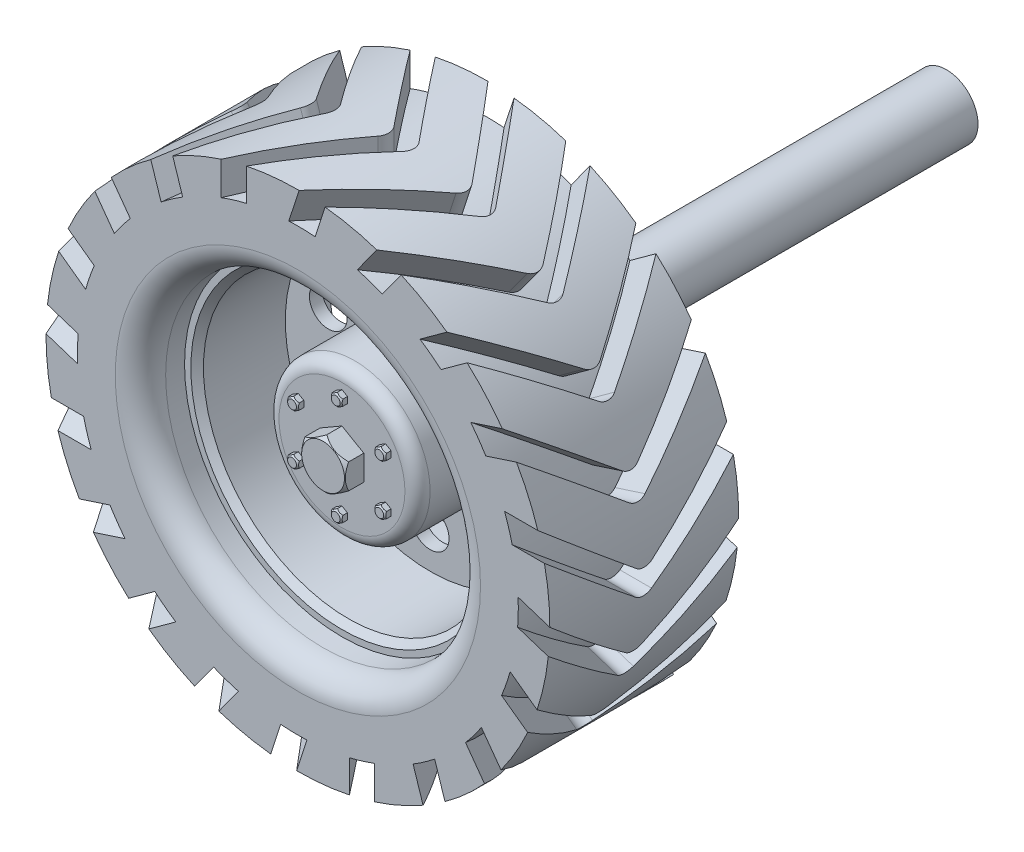
from build123d import *

# Parameters (mm, degrees)
SKETCH_1_R               = 125
EXTRUDE_1_DEPTH          = 40
SHELL_1_T                = -10
SKETCH_3_R               = 200
SKETCH_3_R_2             = 125
EXTRUDE_2_DEPTH          = 75
CHAMFER_1_SIZE           = 5
FILLET_2_R               = 20
SKETCH_4_R               = 60
EXTRUDE_3_DEPTH          = 70
FILLET_4_R               = 10
SKETCH_5_R               = 15
CUT_EXTRUDE_2_DEPTH      = 100
PATTERN_CIRCULAR_1_COUNT = 10
FILLET_5_R               = 5
SKETCH_7_R               = 20
EXTRUDE_5_DEPTH          = 15
CHAMFER_2_SIZE           = 3
CUT_EXTRUDE_START        = -15
CUT_EXTRUDE_3_DEPTH      = 15
SKETCH_9_R               = 5
EXTRUDE_6_DEPTH          = 5
CHAMFER_3_SIZE           = 1.5
PATTERN_CIRCULAR_2_COUNT = 6
CHAMFER_4_SIZE           = 1.5
CUT_EXTRUDE_START_2      = -5
CUT_EXTRUDE_4_DEPTH      = 5
PATTERN_CIRCULAR_4_COUNT = 6
CUT_EXTRUDE_5_REACH      = 545.714
CUT_EXTRUDE_5_END_RADIUS = 175
PATTERN_CIRCULAR_6_COUNT = 20
SKETCH_14_R              = 25
EXTRUDE_7_DEPTH          = 400


with BuildPart() as part:
    # 草圖1 → 填料-伸長1 (new, symmetric)
    with BuildSketch(Plane.XY):
        Circle(SKETCH_1_R)
    extrude(amount=EXTRUDE_1_DEPTH, both=True)

    # 薄殼1
    shell_1_openings = [part.faces().sort_by_distance(p)[0] for p in [
        (0, 0, 40),
    ]]
    offset(amount=SHELL_1_T, openings=shell_1_openings, kind=Kind.INTERSECTION)

    # 草圖3 → 填料-伸長2 (add, symmetric)
    with BuildSketch(Plane.XY):
        Circle(SKETCH_3_R)
        Circle(SKETCH_3_R_2, mode=Mode.SUBTRACT)
    extrude(amount=EXTRUDE_2_DEPTH, both=True)

    # 導角1
    chamfer_1_edges = [part.edges().sort_by_distance(p)[0] for p in [
        (-115, 0, 40),
    ]]
    chamfer(chamfer_1_edges, length=CHAMFER_1_SIZE)

    # 圓角2
    fillet_2_edges = [part.edges().sort_by_distance(p)[0] for p in [
        (-125, 0, 75),
    ]]
    fillet(fillet_2_edges, radius=FILLET_2_R)

    # 草圖4 → 填料-伸長3 (add)
    with BuildSketch(Plane.XY.offset(-30)):
        Circle(SKETCH_4_R)
    extrude(amount=EXTRUDE_3_DEPTH)

    # 圓角4
    fillet_4_edges = [part.edges().sort_by_distance(p)[0] for p in [
        (-60, 0, 40),
    ]]
    fillet(fillet_4_edges, radius=FILLET_4_R)

    # 草圖5 → 除料-伸長2 (cut)
    with BuildSketch(Plane.XY.offset(-30)):
        with Locations((0, 85)):
            Circle(SKETCH_5_R)
    cut_extrude_2 = extrude(amount=-CUT_EXTRUDE_2_DEPTH, mode=Mode.SUBTRACT)

    # 環狀複製排列1: 除料-伸長2 ×10 about axis
    pattern_circular_1_axis = Axis((0, 0, 0), (0, 0, 1))
    for i in range(1, PATTERN_CIRCULAR_1_COUNT):
        add(cut_extrude_2.rotate(pattern_circular_1_axis, i * 360 / PATTERN_CIRCULAR_1_COUNT), mode=Mode.SUBTRACT)

    # 圓角5
    fillet_5_edges = [part.edges().sort_by_distance(p)[0] for p in [
        (-60, 0, -30),
    ]]
    fillet(fillet_5_edges, radius=FILLET_5_R)

    # 草圖7 → 填料-伸長5 (add)
    with BuildSketch(Plane.XY.offset(40)):
        Circle(SKETCH_7_R)
    extrude(amount=EXTRUDE_5_DEPTH)

    # 導角2
    chamfer_2_edges = [part.edges().sort_by_distance(p)[0] for p in [
        (-20, 0, 55),
    ]]
    chamfer(chamfer_2_edges, length=CHAMFER_2_SIZE)

    # 草圖8 → 除料-伸長3 (cut)
    with BuildSketch(Plane.XY.offset(55).offset(CUT_EXTRUDE_START)):
        with BuildLine():
            Line((-17.320508076, 10), (0, 20))
            ThreePointArc((0, 20), (-10, 17.320508076), (-17.320508076, 10))
        make_face()
        with BuildLine():
            ThreePointArc((17.320508076, 10), (10, 17.320508076), (0, 20))
            Line((0, 20), (17.320508076, 10))
        make_face()
        with BuildLine():
            Line((-17.320508076, -10), (-17.320508076, 10))
            ThreePointArc((-17.320508076, 10), (-20, 0), (-17.320508076, -10))
        make_face()
        with BuildLine():
            Line((0, -20), (-17.320508076, -10))
            ThreePointArc((-17.320508076, -10), (-10, -17.320508076), (0, -20))
        make_face()
        with BuildLine():
            ThreePointArc((0, -20), (10, -17.320508076), (17.320508076, -10))
            Line((17.320508076, -10), (0, -20))
        make_face()
        with BuildLine():
            ThreePointArc((20, 0), (19.318516526, 5.176380902), (17.320508076, 10))
            Line((17.320508076, 10), (17.320508076, -10))
            ThreePointArc((17.320508076, -10), (19.318516526, -5.176380902), (20, 0))
        make_face()
    extrude(amount=CUT_EXTRUDE_3_DEPTH, mode=Mode.SUBTRACT)

    # 草圖9 → 填料-伸長6 (add)
    with BuildSketch(Plane.XY.offset(40)):
        with Locations((0, 40)):
            Circle(SKETCH_9_R)
    extrude_6 = extrude(amount=EXTRUDE_6_DEPTH)

    # 導角3
    chamfer_3_edges = [part.edges().sort_by_distance(p)[0] for p in [
        (-5, 40, 45),
    ]]
    chamfer(chamfer_3_edges, length=CHAMFER_3_SIZE)

    # 環狀複製排列2: 填料-伸長6 ×6 about axis
    pattern_circular_2_axis = Axis((0, 0, 0), (0, 0, 1))
    for i in range(1, PATTERN_CIRCULAR_2_COUNT):
        add(extrude_6.rotate(pattern_circular_2_axis, i * 360 / PATTERN_CIRCULAR_2_COUNT))

    # 導角4
    chamfer_4_edges = [part.edges().sort_by_distance(p)[0] for p in [
        (-37.141016151, 15.669872981, 45),
        (-32.141016151, -24.330127019, 45),
        (5, -40, 45),
        (37.141016151, -15.669872981, 45),
        (32.141016151, 24.330127019, 45),
    ]]
    chamfer(chamfer_4_edges, length=CHAMFER_4_SIZE)

    # 草圖10 → 除料-伸長4 (cut)
    with BuildSketch(Plane.XY.offset(45).offset(CUT_EXTRUDE_START_2)):
        with BuildLine():
            Line((-4.330127019, 42.5), (0, 45))
            ThreePointArc((0, 45), (-2.5, 44.330127019), (-4.330127019, 42.5))
        make_face()
        with BuildLine():
            ThreePointArc((4.330127019, 42.5), (2.5, 44.330127019), (0, 45))
            Line((0, 45), (4.330127019, 42.5))
        make_face()
        with BuildLine():
            Line((-4.330127019, 37.5), (-4.330127019, 42.5))
            ThreePointArc((-4.330127019, 42.5), (-5, 40), (-4.330127019, 37.5))
        make_face()
        with BuildLine():
            Line((0, 35), (-4.330127019, 37.5))
            ThreePointArc((-4.330127019, 37.5), (-2.5, 35.669872981), (0, 35))
        make_face()
        with BuildLine():
            ThreePointArc((0, 35), (2.5, 35.669872981), (4.330127019, 37.5))
            Line((4.330127019, 37.5), (0, 35))
        make_face()
        with BuildLine():
            ThreePointArc((5, 40), (4.829629131, 41.294095226), (4.330127019, 42.5))
            Line((4.330127019, 42.5), (4.330127019, 37.5))
            ThreePointArc((4.330127019, 37.5), (4.829629131, 38.705904774), (5, 40))
        make_face()
    cut_extrude_4 = extrude(amount=CUT_EXTRUDE_4_DEPTH, mode=Mode.SUBTRACT)

    # 環狀複製排列4: 除料-伸長4 ×6 about axis
    pattern_circular_4_axis = Axis((0, 0, 0), (0, 0, 1))
    for i in range(1, PATTERN_CIRCULAR_4_COUNT):
        add(cut_extrude_4.rotate(pattern_circular_4_axis, i * 360 / PATTERN_CIRCULAR_4_COUNT), mode=Mode.SUBTRACT)

    # 除料-伸長5: up to this cylinder (the profile starts outside it)
    cut_extrude_5_end = Plane(origin=(0, 0, -39.585833), z_dir=(0, 0, -1)) * Cylinder(CUT_EXTRUDE_5_END_RADIUS, 1442.428, mode=Mode.PRIVATE)
    # 草圖11 → 除料-伸長5 (cut, up to the surface)
    with BuildSketch(Plane(origin=(0, 300, 0), x_dir=(1, 0, 0), z_dir=(0, 1, 0)), mode=Mode.PRIVATE) as cut_extrude_5_sk1:
        with BuildLine():
            Line((-5.117227478, -6.302992351), (-60.890453209, -75))
            Line((-60.890453209, -75), (-40.890453209, -75))
            Line((-40.890453209, -75), (14.882772522, -6.302992351))
            ThreePointArc((14.882772522, -6.302992351), (17.119249648, 0), (14.882772522, 6.302992351))
            Line((14.882772522, 6.302992351), (-40.890453209, 75))
            Line((-40.890453209, 75), (-60.890453209, 75))
            Line((-60.890453209, 75), (-5.117227478, 6.302992351))
            ThreePointArc((-5.117227478, 6.302992351), (-2.880750352, 0), (-5.117227478, -6.302992351))
        make_face()
    cut_extrude_5_tool1 = extrude(cut_extrude_5_sk1.sketch, amount=-CUT_EXTRUDE_5_REACH, mode=Mode.PRIVATE) - cut_extrude_5_end
    cut_extrude_5 = cut_extrude_5_tool1.solids().sort_by_distance((-14.316439, 300, -39.585833))[0]
    add(cut_extrude_5, mode=Mode.SUBTRACT)

    # 環狀複製排列6: 除料-伸長5 ×20 about axis
    pattern_circular_6_axis = Axis((0, 0, 0), (0, 0, 1))
    for i in range(1, PATTERN_CIRCULAR_6_COUNT):
        add(cut_extrude_5.rotate(pattern_circular_6_axis, i * 360 / PATTERN_CIRCULAR_6_COUNT), mode=Mode.SUBTRACT)

    # 草圖14 → 填料-伸長7 (add)
    with BuildSketch(Plane(origin=(0, 0, -40), x_dir=(-1, 0, 0), z_dir=(0, 0, -1))):
        with Locations(Location((0, 0, 0), (0, 0, 180))):
            Circle(SKETCH_14_R)
    extrude(amount=EXTRUDE_7_DEPTH)


solid = part.part
